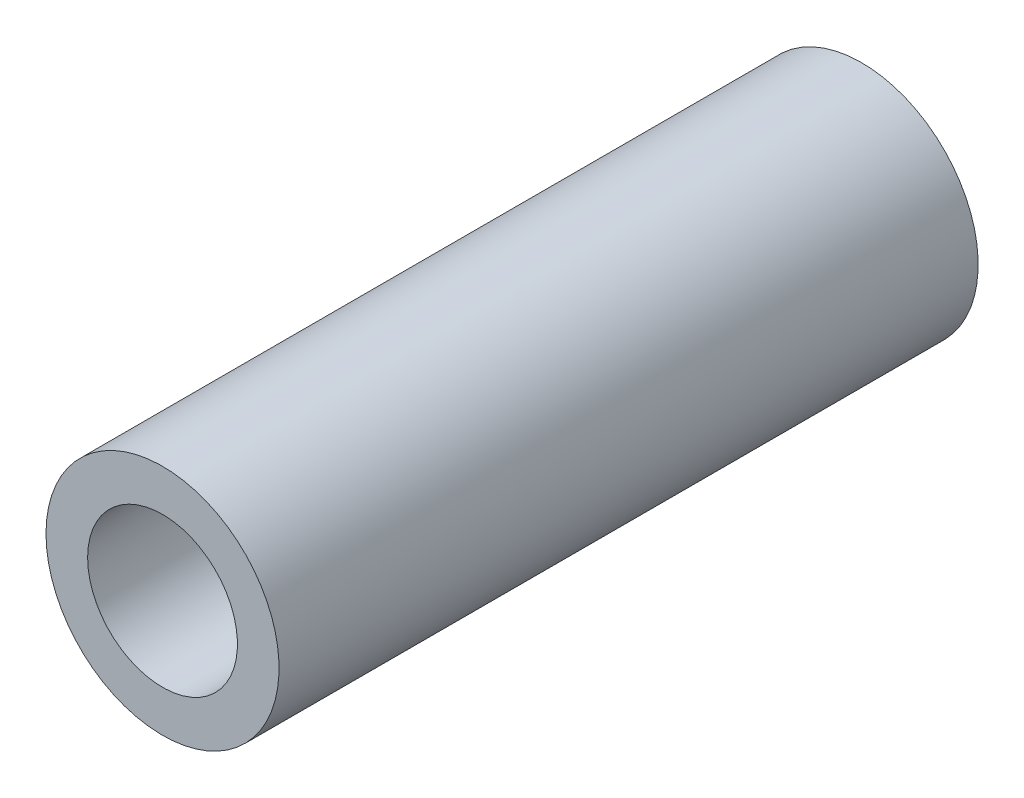
from build123d import *

# Parameters (mm, degrees)
SKETCH2_R           = 3.5
SKETCH2_R_2         = 2.25
BOSS_EXTRUDE1_DEPTH = 21


with BuildPart() as part:
    # Sketch2 → Boss-Extrude1 (new body)
    with BuildSketch(Plane.XY):
        with Locations(Location((0, 0, 0), (0, 0, 180))):
            Circle(SKETCH2_R)
        with Locations(Location((0, 0, 0), (0, 0, 180))):
            Circle(SKETCH2_R_2, mode=Mode.SUBTRACT)
    extrude(amount=BOSS_EXTRUDE1_DEPTH)


solid = part.part
